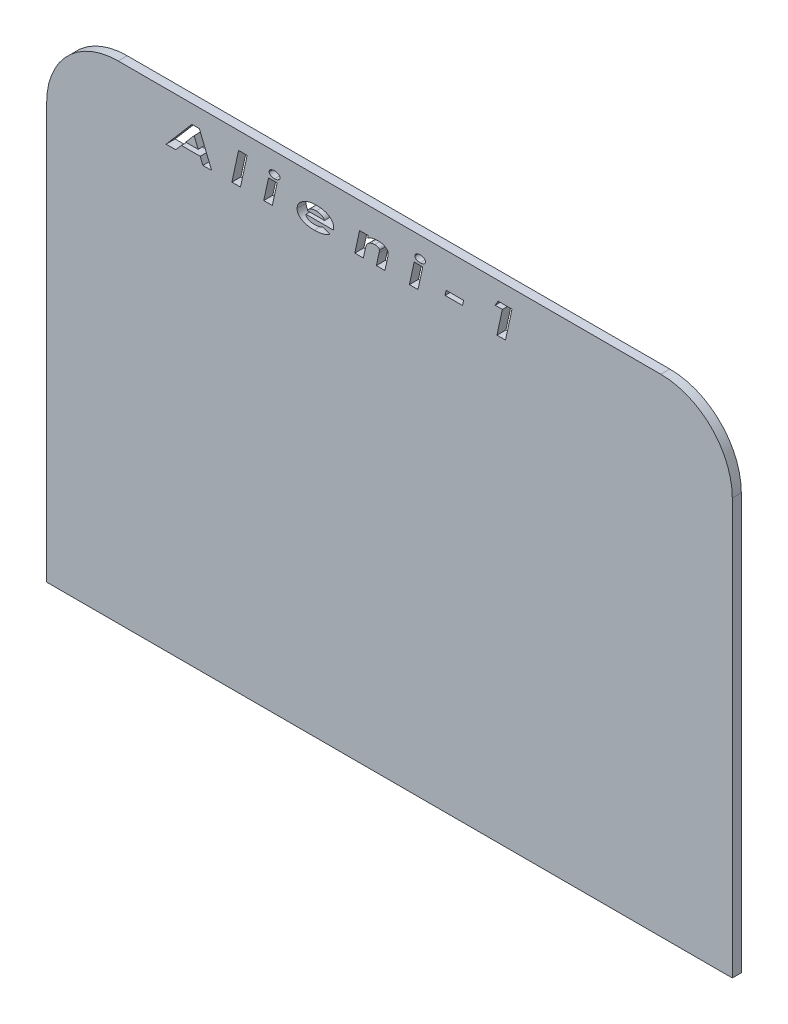
from build123d import *

# Parameters (mm, degrees)
SALIENTE_EXTRUIR1_DEPTH = 1.5
CORTAR_EXTRUIR1_REACH   = 103.525
CORTAR_EXTRUIR2_DEPTH   = 102.524627694


with BuildPart() as part:
    # Croquis1 → Saliente-Extruir1 (new body)
    with BuildSketch(Plane.XY):
        Polygon((-57, 84), (-57, 69), (-57, 3), (57, 3), (57, 69), (57, 84), align=None)
    extrude(amount=SALIENTE_EXTRUIR1_DEPTH)

    # Croquis2 → Cortar-Extruir1 (cut, up to next)
    with BuildSketch(Plane.XY.offset(1.5), mode=Mode.PRIVATE) as cortar_extruir1_sk1:
        Polygon((-32.857818298, 81), (-31.610823105, 81), (-29.5775699, 76), (-31.033900028, 76), (-31.477609964, 77.08974359), (-34.603611567, 77.08974359), (-35.537105157, 76), (-37.141672464, 76), align=None)
        Polygon((-31.816151631, 77.923076923), (-32.483218939, 79.563701923), (-33.889468939, 77.923076923), align=None, mode=Mode.SUBTRACT)
    cortar_extruir1_tool1 = extrude(cortar_extruir1_sk1.sketch, amount=-CORTAR_EXTRUIR1_REACH, mode=Mode.PRIVATE) & part.part
    # Croquis2 → Cortar-Extruir1 (cut, up to next)
    with BuildSketch(Plane.XY.offset(1.5), mode=Mode.PRIVATE) as cortar_extruir1_sk2:
        Polygon((-25.094997785, 81.128205128), (-23.671720541, 81.128205128), (-24.782497785, 76), (-26.205775028, 76), align=None)
    cortar_extruir1_tool2 = extrude(cortar_extruir1_sk2.sketch, amount=-CORTAR_EXTRUIR1_REACH, mode=Mode.PRIVATE) & part.part
    # Croquis2 → Cortar-Extruir1 (cut, up to next)
    with BuildSketch(Plane.XY.offset(1.5), mode=Mode.PRIVATE) as cortar_extruir1_sk3:
        with BuildLine():
            add(Edge.make_bspline(
                [(-19.116031439, 81.192307692), (-19.056482759, 81.190104299), (-18.940875619, 81.185826657), (-18.773711163, 81.155261883), (-18.620796661, 81.100218367), (-18.504938803, 81.038085309), (-18.421320659, 80.980928801), (-18.36755426, 80.934998473), (-18.321283883, 80.887492351), (-18.284110445, 80.83717168), (-18.254690551, 80.78471426), (-18.233179593, 80.730260737), (-18.220907058, 80.673357726), (-18.219369894, 80.634805468), (-18.218595541, 80.615384615)],
                knots=[0, 0, 0, 0, 1.82954923, 3.551866371, 5.197020351, 6.803431217, 7.577477611, 8.305201642, 8.972733238, 9.610843553, 10.221651276, 10.816042065, 11.403576496, 12, 12, 12, 12], degree=3))
            add(Edge.make_bspline(
                [(-18.218595541, 80.615384615), (-18.219370215, 80.595964085), (-18.220908017, 80.557412469), (-18.233175807, 80.500504686), (-18.254705109, 80.446069614), (-18.284053378, 80.393540151), (-18.321657211, 80.343311542), (-18.366822503, 80.294649556), (-18.422035224, 80.250075053), (-18.5042594, 80.191110793), (-18.620764748, 80.129519442), (-18.773889436, 80.075755558), (-18.940856999, 80.044869167), (-19.056476428, 80.040639975), (-19.116031439, 80.038461538)],
                knots=[0, 0, 0, 0, 0.596259379, 1.183632131, 1.777859354, 2.388498994, 3.026433712, 3.701226864, 4.42214226, 5.201866064, 6.807834874, 8.449111039, 10.17095423, 12, 12, 12, 12], degree=3))
            add(Edge.make_bspline(
                [(-19.116031439, 80.038461538), (-19.175584872, 80.040643617), (-19.291201241, 80.044879881), (-19.458190397, 80.075716393), (-19.611516899, 80.129755864), (-19.728495004, 80.190999432), (-19.810983591, 80.249737138), (-19.865282627, 80.294993912), (-19.910438175, 80.343273004), (-19.948001394, 80.39354976), (-19.977359836, 80.446067163), (-19.998886533, 80.500505323), (-20.011154997, 80.557412307), (-20.012692708, 80.595964031), (-20.013467336, 80.615384615)],
                knots=[0, 0, 0, 0, 1.828863321, 3.550534756, 5.191647203, 6.806500673, 7.586146699, 8.299142337, 8.973868178, 9.611739261, 10.222317989, 10.816485938, 11.403800098, 12, 12, 12, 12], degree=3))
            add(Edge.make_bspline(
                [(-20.013467336, 80.615384615), (-20.01269303, 80.634805523), (-20.011155959, 80.673357888), (-19.998882732, 80.730260098), (-19.977374451, 80.784716718), (-19.947944105, 80.837162047), (-19.910812233, 80.887530799), (-19.864551058, 80.934661074), (-19.811699318, 80.981259835), (-19.727810096, 81.038192023), (-19.611485123, 81.099979911), (-19.458368444, 81.155300927), (-19.291182686, 81.185815986), (-19.175578564, 81.190100671), (-19.116031439, 81.192307692)],
                knots=[0, 0, 0, 0, 0.596360412, 1.183832691, 1.778160602, 2.388903712, 3.026946525, 3.694407506, 4.414276675, 5.188241187, 6.803529412, 8.448509361, 10.170644308, 12, 12, 12, 12], degree=3))
        make_face()
    cortar_extruir1_tool3 = extrude(cortar_extruir1_sk3.sketch, amount=-CORTAR_EXTRUIR1_REACH, mode=Mode.PRIVATE) & part.part
    # Croquis2 → Cortar-Extruir1 (cut, up to next)
    with BuildSketch(Plane.XY.offset(1.5), mode=Mode.PRIVATE) as cortar_extruir1_sk4:
        Polygon((-20.10861958, 79.653846154), (-18.685342336, 79.653846154), (-19.48762599, 76), (-20.910903234, 76), align=None)
    cortar_extruir1_tool4 = extrude(cortar_extruir1_sk4.sketch, amount=-CORTAR_EXTRUIR1_REACH, mode=Mode.PRIVATE) & part.part
    # Croquis2 → Cortar-Extruir1 (cut, up to next)
    with BuildSketch(Plane.XY.offset(1.5), mode=Mode.PRIVATE) as cortar_extruir1_sk5:
        with BuildLine():
            Line((-11.097802272, 77.080729167), (-9.873843939, 76.678084936))
            add(Edge.make_bspline(
                [(-9.873843939, 76.678084936), (-9.909910289, 76.649929924), (-9.983140748, 76.592762943), (-10.101114649, 76.513848386), (-10.226744401, 76.438483475), (-10.362303855, 76.369867704), (-10.505138951, 76.303178766), (-10.657678912, 76.242830764), (-10.817830006, 76.185389259), (-10.986059109, 76.133765965), (-11.160280986, 76.086600573), (-11.340497289, 76.046637026), (-11.525285195, 76.012802347), (-11.715026355, 75.984669191), (-11.909133353, 75.962850974), (-12.108181875, 75.946503021), (-12.311996155, 75.937675102), (-12.449624108, 75.936493644), (-12.519076311, 75.935897436)],
                knots=[0, 0, 0, 0, 0.785005778, 1.593904903, 2.434080468, 3.297687571, 4.200110939, 5.138559736, 6.111768696, 7.119434765, 8.157686377, 9.208619705, 10.286388906, 11.381143794, 12.499852874, 13.638054645, 14.808074204, 16, 16, 16, 16], degree=3))
            add(Edge.make_bspline(
                [(-12.519076311, 75.935897436), (-12.626291625, 75.937061479), (-12.834952474, 75.939326923), (-13.13881094, 75.962090423), (-13.42557615, 75.997193218), (-13.694652082, 76.048664558), (-13.947362535, 76.111371289), (-14.18148903, 76.192176783), (-14.398803679, 76.286081928), (-14.597809317, 76.393644041), (-14.776527114, 76.513084), (-14.931736737, 76.64406238), (-15.064957431, 76.783217205), (-15.171916876, 76.934196156), (-15.256317723, 77.09400879), (-15.316978057, 77.263457573), (-15.352763102, 77.44314663), (-15.357306508, 77.566011372), (-15.359621182, 77.628605769)],
                knots=[0, 0, 0, 0, 1.400534497, 2.725699392, 3.978747606, 5.173027507, 6.30291992, 7.37750432, 8.405049034, 9.39268301, 10.329081328, 11.208172899, 12.041326087, 12.838951887, 13.617455642, 14.395604929, 15.182628465, 16, 16, 16, 16], degree=3))
            add(Edge.make_bspline(
                [(-15.359621182, 77.628605769), (-15.35875343, 77.664686543), (-15.357022022, 77.736677788), (-15.346116857, 77.84355352), (-15.326750247, 77.948225496), (-15.300621612, 78.050605182), (-15.267923119, 78.150985122), (-15.226186264, 78.248882949), (-15.177068884, 78.344783277), (-15.121065286, 78.438925779), (-15.05762264, 78.530743561), (-14.985804999, 78.619634551), (-14.908270789, 78.708207917), (-14.821444829, 78.792969103), (-14.728145048, 78.876526095), (-14.627148818, 78.957416963), (-14.518082038, 79.035658663), (-14.363586423, 79.1384079), (-14.158882894, 79.256708121), (-13.900480154, 79.380603837), (-13.629187163, 79.4842776), (-13.346313373, 79.571035387), (-13.050518543, 79.636913104), (-12.742581873, 79.683107225), (-12.422199834, 79.713589438), (-12.204311062, 79.7164782), (-12.093395221, 79.717948718)],
                knots=[0, 0, 0, 0, 0.608777923, 1.214682387, 1.810207526, 2.40314289, 2.996319018, 3.589521891, 4.19665577, 4.812996442, 5.436452024, 6.077770101, 6.740165273, 7.421289004, 8.1234473, 8.852737523, 9.603170971, 10.387449591, 11.982575143, 13.587507182, 15.217334931, 16.878058434, 18.575368804, 20.324839207, 22.129166782, 24, 24, 24, 24], degree=3))
            add(Edge.make_bspline(
                [(-12.093395221, 79.717948718), (-12.026279994, 79.717001746), (-11.893980324, 79.715135044), (-11.698434738, 79.705675589), (-11.508789965, 79.686884547), (-11.324159218, 79.663627418), (-11.145369414, 79.631573643), (-10.972482177, 79.591957058), (-10.80463215, 79.547600277), (-10.643161191, 79.494125176), (-10.487856406, 79.435929215), (-10.34133441, 79.369322943), (-10.202865215, 79.297190888), (-10.072116207, 79.219497545), (-9.950876139, 79.133686433), (-9.836978807, 79.042912932), (-9.732841436, 78.944104575), (-9.636933727, 78.840542961), (-9.550680554, 78.732538808), (-9.47572812, 78.621646188), (-9.411594601, 78.508787393), (-9.360435849, 78.392869234), (-9.320321999, 78.274512817), (-9.290937266, 78.153939008), (-9.273582261, 78.031087773), (-9.271115695, 77.948504336), (-9.269877593, 77.907051282)],
                knots=[0, 0, 0, 0, 1.302021479, 2.56658613, 3.796171328, 4.997929922, 6.175591144, 7.317814968, 8.437957677, 9.541862431, 10.615975079, 11.653661094, 12.661740851, 13.643599382, 14.601280189, 15.540921628, 16.466395113, 17.383033978, 18.277157581, 19.14475838, 19.97699937, 20.791744348, 21.598678188, 22.398223061, 23.195982296, 24, 24, 24, 24], degree=3))
            add(Edge.make_bspline(
                [(-9.269877593, 77.907051282), (-9.27040903, 77.879641985), (-9.271514076, 77.822648315), (-9.282826747, 77.733799934), (-9.298128138, 77.638004186), (-9.313829058, 77.572425994), (-9.321960926, 77.538461538)],
                knots=[0, 0, 0, 0, 0.881110856, 1.832142653, 2.877216765, 4, 4, 4, 4], degree=3))
            Line((-9.321960926, 77.538461538), (-13.885262208, 77.538461538))
            add(Edge.make_bspline(
                [(-13.885262208, 77.538461538), (-13.882333955, 77.509631916), (-13.876579538, 77.452977769), (-13.855243827, 77.370915185), (-13.8226971, 77.293767824), (-13.779090182, 77.221046371), (-13.724369092, 77.152529493), (-13.658957525, 77.088548967), (-13.58315179, 77.028962351), (-13.496512943, 76.975327839), (-13.400642678, 76.926040168), (-13.294976776, 76.884694128), (-13.181116505, 76.847916396), (-13.058277917, 76.819997948), (-12.927030416, 76.796228522), (-12.787112514, 76.781174733), (-12.638432973, 76.770502855), (-12.536458589, 76.769662768), (-12.484020221, 76.769230769)],
                knots=[0, 0, 0, 0, 0.790043653, 1.552543685, 2.303964583, 3.068150661, 3.859402051, 4.69062318, 5.560169329, 6.485507048, 7.467652495, 8.498150384, 9.578834284, 10.730380231, 11.933378626, 13.21740722, 14.569105095, 16, 16, 16, 16], degree=3))
            add(Edge.make_bspline(
                [(-12.484020221, 76.769230769), (-12.419897921, 76.770294595), (-12.29316962, 76.77239709), (-12.105782078, 76.786022382), (-11.924006131, 76.811616378), (-11.747786178, 76.845519289), (-11.576497623, 76.888118727), (-11.411628314, 76.942833559), (-11.25123827, 77.005308058), (-11.148887617, 77.055618284), (-11.097802272, 77.080729167)],
                knots=[0, 0, 0, 0, 1.073005374, 2.120637401, 3.141425622, 4.142859629, 5.122505142, 6.092417034, 7.047885572, 8, 8, 8, 8], degree=3))
        make_face()
        with BuildLine():
            add(Edge.make_bspline(
                [(-10.808339131, 78.179487179), (-10.821493225, 78.207808595), (-10.847656076, 78.264138509), (-10.896038347, 78.34309594), (-10.950881081, 78.416674338), (-11.010565008, 78.486256812), (-11.077998033, 78.549357277), (-11.152026347, 78.606393356), (-11.230953662, 78.660204537), (-11.347488233, 78.722819582), (-11.506117941, 78.788912278), (-11.713537267, 78.844413916), (-11.938981965, 78.879132003), (-12.095599598, 78.882747275), (-12.176528234, 78.884615385)],
                knots=[0, 0, 0, 0, 0.688214886, 1.368825829, 2.037382497, 2.710625744, 3.387763039, 4.069686945, 4.770120888, 5.49171267, 6.983528956, 8.54820585, 10.216363099, 12, 12, 12, 12], degree=3))
            add(Edge.make_bspline(
                [(-12.176528234, 78.884615385), (-12.257801158, 78.882786627), (-12.417135374, 78.879201377), (-12.649325198, 78.842617124), (-12.870089939, 78.786260073), (-13.04316056, 78.717943106), (-13.173889339, 78.653870642), (-13.265354462, 78.600297483), (-13.3515966, 78.542838814), (-13.430697681, 78.479157824), (-13.504461397, 78.412025486), (-13.571636733, 78.339561853), (-13.633305245, 78.262435058), (-13.669034625, 78.207183467), (-13.6869449, 78.179487179)],
                knots=[0, 0, 0, 0, 1.680265806, 3.294133173, 4.850613434, 6.386059732, 7.133645933, 7.861078898, 8.577607185, 9.27558252, 9.960027778, 10.63940002, 11.317964092, 12, 12, 12, 12], degree=3))
            Line((-13.6869449, 78.179487179), (-10.808339131, 78.179487179))
        make_face(mode=Mode.SUBTRACT)
    cortar_extruir1_tool5 = extrude(cortar_extruir1_sk5.sketch, amount=-CORTAR_EXTRUIR1_REACH, mode=Mode.PRIVATE) & part.part
    # Croquis2 → Cortar-Extruir1 (cut, up to next)
    with BuildSketch(Plane.XY.offset(1.5), mode=Mode.PRIVATE) as cortar_extruir1_sk6:
        with BuildLine():
            Line((-4.967593939, 79.653846154), (-3.544316695, 79.653846154))
            Line((-3.544316695, 79.653846154), (-3.634460926, 79.245192308))
            add(Edge.make_bspline(
                [(-3.634460926, 79.245192308), (-3.5665082, 79.28320068), (-3.431779534, 79.358559204), (-3.223131291, 79.453842443), (-3.013303208, 79.535784236), (-2.801012169, 79.601889591), (-2.586977134, 79.654212368), (-2.37047257, 79.691322464), (-2.152249657, 79.714096829), (-2.005909173, 79.716664746), (-1.932738169, 79.717948718)],
                knots=[0, 0, 0, 0, 1.045366278, 2.072629186, 3.077749738, 4.06912246, 5.056664433, 6.034939076, 7.017459305, 8, 8, 8, 8], degree=3))
            add(Edge.make_bspline(
                [(-1.932738169, 79.717948718), (-1.871287933, 79.716833565), (-1.750920834, 79.714649232), (-1.574589677, 79.702082241), (-1.407028017, 79.678982474), (-1.24812349, 79.646909833), (-1.097208161, 79.606313527), (-0.955276331, 79.554792647), (-0.82096164, 79.496292781), (-0.697472861, 79.426969839), (-0.585081638, 79.352217002), (-0.486676346, 79.271385457), (-0.40282242, 79.186206117), (-0.333528689, 79.095797818), (-0.281450489, 78.999391618), (-0.242171452, 78.899452889), (-0.219987461, 78.793764038), (-0.216671009, 78.72178527), (-0.214989772, 78.685296474)],
                knots=[0, 0, 0, 0, 1.334083249, 2.61316702, 3.834971113, 5.003370311, 6.130417109, 7.223967118, 8.278512441, 9.307007492, 10.294009962, 11.205300836, 12.066353822, 12.883908205, 13.668846133, 14.437418119, 15.20786738, 16, 16, 16, 16], degree=3))
            add(Edge.make_bspline(
                [(-0.214989772, 78.685296474), (-0.216460111, 78.646192965), (-0.219750274, 78.558691438), (-0.23842556, 78.415030806), (-0.266323385, 78.245228243), (-0.292217986, 78.124293756), (-0.306135605, 78.059294872)],
                knots=[0, 0, 0, 0, 0.740872328, 1.657842481, 2.741156229, 4, 4, 4, 4], degree=3))
            Line((-0.306135605, 78.059294872), (-0.755855157, 76))
            Line((-0.755855157, 76), (-2.180134003, 76))
            Line((-2.180134003, 76), (-1.74143208, 78.011217949))
            add(Edge.make_bspline(
                [(-1.74143208, 78.011217949), (-1.731726569, 78.056891334), (-1.713645624, 78.141978864), (-1.693731361, 78.260923337), (-1.680339524, 78.361479908), (-1.67826233, 78.422511946), (-1.677329516, 78.449919872)],
                knots=[0, 0, 0, 0, 1.261691984, 2.350477275, 3.259241588, 4, 4, 4, 4], degree=3))
            add(Edge.make_bspline(
                [(-1.677329516, 78.449919872), (-1.679848103, 78.482992555), (-1.684775282, 78.547693524), (-1.72360494, 78.638806252), (-1.790311223, 78.714945809), (-1.88088762, 78.777032427), (-1.993484015, 78.82490387), (-2.126469411, 78.86104078), (-2.280694006, 78.881073784), (-2.390413519, 78.883388575), (-2.44856349, 78.884615385)],
                knots=[0, 0, 0, 0, 0.803728796, 1.572356006, 2.362482383, 3.237667297, 4.224126175, 5.328652663, 6.584219312, 8, 8, 8, 8], degree=3))
            add(Edge.make_bspline(
                [(-2.44856349, 78.884615385), (-2.508412409, 78.882441887), (-2.629073565, 78.878059908), (-2.810090129, 78.84992465), (-2.990254479, 78.799131875), (-3.167912618, 78.733809382), (-3.336188089, 78.651646408), (-3.485575352, 78.550832482), (-3.61459696, 78.435485275), (-3.706875684, 78.325461422), (-3.770918271, 78.224093059), (-3.816635228, 78.132421151), (-3.862815377, 78.026690812), (-3.90578113, 77.90501703), (-3.950446143, 77.769363441), (-3.993049696, 77.618628623), (-4.033927742, 77.452419171), (-4.059708266, 77.336525402), (-4.073162849, 77.276041667)],
                knots=[0, 0, 0, 0, 1.131741695, 2.281699727, 3.453252361, 4.665708579, 5.857077569, 6.984638948, 8.061973505, 9.119992569, 9.687436956, 10.325491882, 11.054933915, 11.867709394, 12.764051212, 13.755170859, 14.828447366, 16, 16, 16, 16], degree=3))
            Line((-4.073162849, 77.276041667), (-4.346600349, 76))
            Line((-4.346600349, 76), (-5.769877593, 76))
            Line((-5.769877593, 76), (-4.967593939, 79.653846154))
        make_face()
    cortar_extruir1_tool6 = extrude(cortar_extruir1_sk6.sketch, amount=-CORTAR_EXTRUIR1_REACH, mode=Mode.PRIVATE) & part.part
    # Croquis2 → Cortar-Extruir1 (cut, up to next)
    with BuildSketch(Plane.XY.offset(1.5), mode=Mode.PRIVATE) as cortar_extruir1_sk7:
        with BuildLine():
            add(Edge.make_bspline(
                [(5.101917279, 81.192307692), (5.161465959, 81.190104299), (5.277073099, 81.185826657), (5.444237555, 81.155261883), (5.597152057, 81.100218367), (5.713009915, 81.038085309), (5.796628059, 80.980928801), (5.850394457, 80.934998473), (5.896664835, 80.887492351), (5.933838273, 80.83717168), (5.963258167, 80.78471426), (5.984769125, 80.730260737), (5.99704166, 80.673357726), (5.998578824, 80.634805468), (5.999353177, 80.615384615)],
                knots=[0, 0, 0, 0, 1.82954923, 3.551866371, 5.197020351, 6.803431217, 7.577477611, 8.305201642, 8.972733238, 9.610843553, 10.221651276, 10.816042065, 11.403576496, 12, 12, 12, 12], degree=3))
            add(Edge.make_bspline(
                [(5.999353177, 80.615384615), (5.998578503, 80.595964085), (5.997040701, 80.557412469), (5.984772911, 80.500504686), (5.963243609, 80.446069614), (5.93389534, 80.393540151), (5.896291507, 80.343311542), (5.851126215, 80.294649556), (5.795913494, 80.250075053), (5.713689318, 80.191110793), (5.59718397, 80.129519442), (5.444059282, 80.075755558), (5.277091719, 80.044869167), (5.16147229, 80.040639975), (5.101917279, 80.038461538)],
                knots=[0, 0, 0, 0, 0.596259379, 1.183632131, 1.777859354, 2.388498994, 3.026433712, 3.701226864, 4.42214226, 5.201866064, 6.807834874, 8.449111039, 10.17095423, 12, 12, 12, 12], degree=3))
            add(Edge.make_bspline(
                [(5.101917279, 80.038461538), (5.042363846, 80.040643617), (4.926747477, 80.044879881), (4.759758321, 80.075716393), (4.606431819, 80.129755864), (4.489453714, 80.190999432), (4.406965127, 80.249737138), (4.352666091, 80.294993912), (4.307510543, 80.343273004), (4.269947324, 80.39354976), (4.240588882, 80.446067163), (4.219062185, 80.500505323), (4.206793721, 80.557412307), (4.20525601, 80.595964031), (4.204481382, 80.615384615)],
                knots=[0, 0, 0, 0, 1.828863321, 3.550534756, 5.191647203, 6.806500673, 7.586146699, 8.299142337, 8.973868178, 9.611739261, 10.222317989, 10.816485938, 11.403800098, 12, 12, 12, 12], degree=3))
            add(Edge.make_bspline(
                [(4.204481382, 80.615384615), (4.205255687, 80.634805523), (4.206792759, 80.673357888), (4.219065986, 80.730260098), (4.240574267, 80.784716718), (4.270004613, 80.837162047), (4.307136485, 80.887530799), (4.35339766, 80.934661074), (4.4062494, 80.981259835), (4.490138622, 81.038192023), (4.606463595, 81.099979911), (4.759580274, 81.155300927), (4.926766032, 81.185815986), (5.042370154, 81.190100671), (5.101917279, 81.192307692)],
                knots=[0, 0, 0, 0, 0.596360412, 1.183832691, 1.778160602, 2.388903712, 3.026946525, 3.694407506, 4.414276675, 5.188241187, 6.803529412, 8.448509361, 10.170644308, 12, 12, 12, 12], degree=3))
        make_face()
    cortar_extruir1_tool7 = extrude(cortar_extruir1_sk7.sketch, amount=-CORTAR_EXTRUIR1_REACH, mode=Mode.PRIVATE) & part.part
    # Croquis2 → Cortar-Extruir1 (cut, up to next)
    with BuildSketch(Plane.XY.offset(1.5), mode=Mode.PRIVATE) as cortar_extruir1_sk8:
        Polygon((4.109329138, 79.653846154), (5.532606382, 79.653846154), (4.730322728, 76), (3.307045484, 76), align=None)
    cortar_extruir1_tool8 = extrude(cortar_extruir1_sk8.sketch, amount=-CORTAR_EXTRUIR1_REACH, mode=Mode.PRIVATE) & part.part
    # Croquis2 → Cortar-Extruir1 (cut, up to next)
    with BuildSketch(Plane.XY.offset(1.5), mode=Mode.PRIVATE) as cortar_extruir1_sk9:
        Polygon((9.415218561, 78.243589744), (12.319865997, 78.243589744), (12.152598369, 77.41025641), (9.24294292, 77.41025641), align=None)
    cortar_extruir1_tool9 = extrude(cortar_extruir1_sk9.sketch, amount=-CORTAR_EXTRUIR1_REACH, mode=Mode.PRIVATE) & part.part
    # Croquis2 → Cortar-Extruir1 (cut, up to next)
    with BuildSketch(Plane.XY.offset(1.5), mode=Mode.PRIVATE) as cortar_extruir1_sk10:
        Polygon((18.05143651, 81), (20.367141638, 81), (19.293423689, 76), (17.871148048, 76), (18.765579138, 80.166666667), (17.5786801, 80.166666667), align=None)
    cortar_extruir1_tool10 = extrude(cortar_extruir1_sk10.sketch, amount=-CORTAR_EXTRUIR1_REACH, mode=Mode.PRIVATE) & part.part
    add(cortar_extruir1_tool1.solids().sort_by_distance((-32.234321, 80.909327, 1.5))[0], mode=Mode.SUBTRACT)
    add(cortar_extruir1_tool2.solids().sort_by_distance((-24.938748, 78.564103, 1.5))[0], mode=Mode.SUBTRACT)
    add(cortar_extruir1_tool3.solids().sort_by_distance((-19.116114, 80.615213, 1.5))[0], mode=Mode.SUBTRACT)
    add(cortar_extruir1_tool4.solids().sort_by_distance((-19.798123, 77.826923, 1.5))[0], mode=Mode.SUBTRACT)
    add(cortar_extruir1_tool5.solids().sort_by_distance((-12.465232, 77.860708, 1.5))[0], mode=Mode.SUBTRACT)
    add(cortar_extruir1_tool6.solids().sort_by_distance((-4.255955, 79.587003, 1.5))[0], mode=Mode.SUBTRACT)
    add(cortar_extruir1_tool7.solids().sort_by_distance((5.101835, 80.615213, 1.5))[0], mode=Mode.SUBTRACT)
    add(cortar_extruir1_tool8.solids().sort_by_distance((4.419826, 77.826923, 1.5))[0], mode=Mode.SUBTRACT)
    add(cortar_extruir1_tool9.solids().sort_by_distance((10.782632, 77.826803, 1.5))[0], mode=Mode.SUBTRACT)
    add(cortar_extruir1_tool10.solids().sort_by_distance((19.03308, 78.724253, 1.5))[0], mode=Mode.SUBTRACT)


with BuildPart() as cortar_extruir1_piece_1:
    # of the separate pieces the step leaves, piece 1, a body of its own (cortar_extruir1_pieces)
    add(part.part.solids().sort_by_distance((-57, 84, 0))[0])

    # Croquis3 → Cortar-Extruir2 (cut, through all)
    with BuildSketch(Plane.XY.offset(1.5)):
        with BuildLine():
            Line((-57, 70.733095197), (-57, 72.117736975))
            ThreePointArc((-57, 72.117736975), (-53.519765736, 80.519765736), (-45.117736975, 84))
            Line((-45.117736975, 84), (-40.189837512, 84))
            Line((-40.189837512, 84), (-41.080639525, 91.448057493))
            Line((-41.080639525, 91.448057493), (-71.289032386, 88.098591339))
            Line((-71.289032386, 88.098591339), (-57, 70.733095197))
        make_face()
        with BuildLine():
            Line((41.080639525, 91.448057493), (40.189837512, 84))
            Line((40.189837512, 84), (45.117736975, 84))
            ThreePointArc((45.117736975, 84), (53.519765736, 80.519765736), (57, 72.117736975))
            Line((57, 72.117736975), (57, 70.733095197))
            Line((57, 70.733095197), (71.289032386, 88.098591339))
            Line((71.289032386, 88.098591339), (41.080639525, 91.448057493))
        make_face()
    extrude(amount=-CORTAR_EXTRUIR2_DEPTH, mode=Mode.SUBTRACT)


with BuildPart() as cortar_extruir1_piece_2:
    # of the separate pieces the step leaves, piece 2, a body of its own (cortar_extruir1_pieces)
    add(part.part.solids().sort_by_distance((-33.889468939, 77.923076923, 1.5))[0])


with BuildPart() as cortar_extruir1_piece_3:
    # of the separate pieces the step leaves, piece 3, a body of its own (cortar_extruir1_pieces)
    add(part.part.solids().sort_by_distance((-13.6869449, 78.179487179, 1.5))[0])


solid = Compound([cortar_extruir1_piece_1.part, cortar_extruir1_piece_2.part, cortar_extruir1_piece_3.part])
